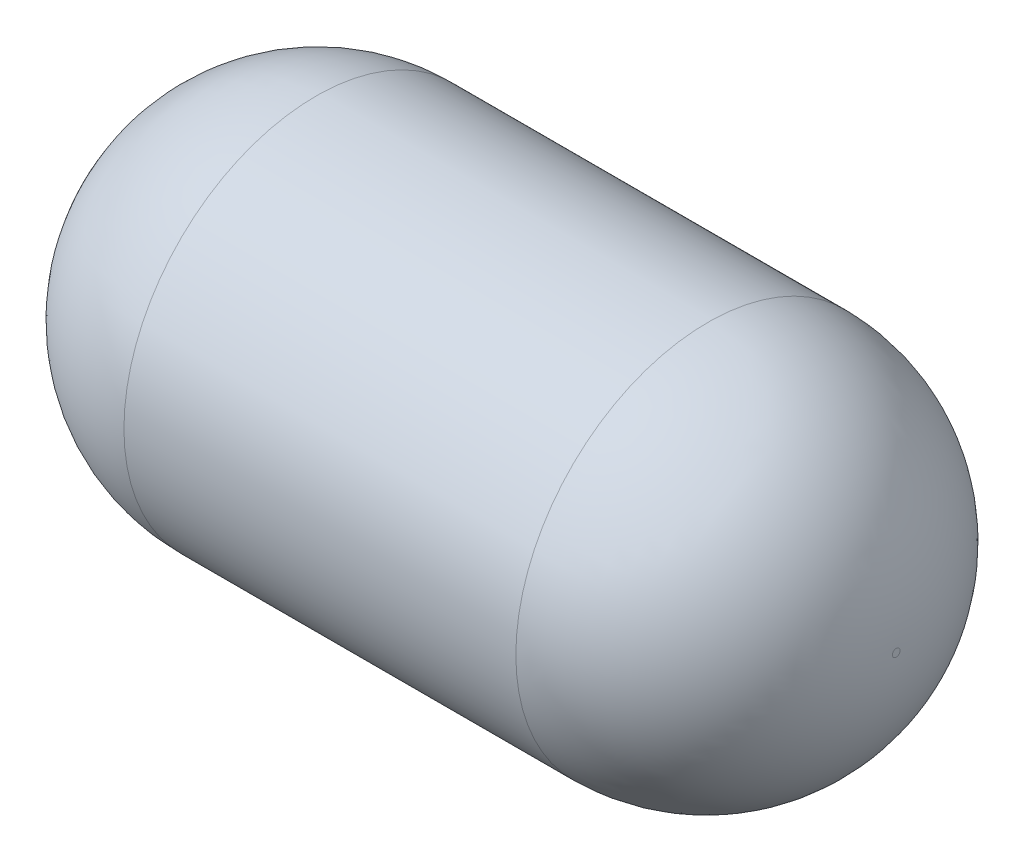
from build123d import *

# Parameters (mm, degrees)
SKETCH3_R            = 3.763336078
BOSS_EXTRUDE2_DEPTH  = 1
SKETCH4_W            = 8.980802585
SKETCH4_H            = 6.293392266
BOSS_EXTRUDE3_DEPTH  = 1
SKETCH5_W            = 10.629346859
SKETCH5_H            = 5.879063528
BOSS_EXTRUDE4_DEPTH  = 1
SKETCH6_W            = 10.265545257
SKETCH6_H            = 5.47495747
SKETCH6_W_2          = 10.065545257
SKETCH6_H_2          = 5.27495747
SKETCH6_W_3          = 9.865545257
SKETCH6_H_3          = 5.07495747
SKETCH6_W_4          = 9.665545257
SKETCH6_H_4          = 4.87495747
SKETCH6_W_5          = 9.465545257
SKETCH6_H_5          = 4.67495747
SKETCH6_W_6          = 9.265545257
SKETCH6_H_6          = 4.47495747
SKETCH6_W_7          = 9.065545257
SKETCH6_H_7          = 4.27495747
SKETCH6_W_8          = 8.865545257
SKETCH6_H_8          = 4.07495747
BOSS_EXTRUDE5_DEPTH  = 0.01
SKETCH8_W            = 8.688080535
SKETCH8_H            = 6.10037594
SKETCH8_W_2          = 8.445827339
SKETCH8_H_2          = 5.836099726
SKETCH8_W_3          = 8.288080535
SKETCH8_H_3          = 5.70037594
SKETCH8_W_4          = 8.045827339
SKETCH8_H_4          = 5.436099726
SKETCH8_W_5          = 7.645827339
SKETCH8_H_5          = 5.036099726
SKETCH8_W_6          = 7.488080535
SKETCH8_H_6          = 4.90037594
BOSS_EXTRUDE6_DEPTH  = 0.01
SKETCH9_R            = 3.620179443
SKETCH9_R_2          = 3.541138501
SKETCH9_R_3          = 3.470179443
SKETCH9_R_4          = 3.391138501
SKETCH9_R_5          = 3.320179443
SKETCH9_R_6          = 3.241138501
SKETCH9_R_7          = 3.170179443
SKETCH9_R_8          = 3.091138501
BOSS_EXTRUDE7_DEPTH  = 0.01
SKETCH10_W           = 4.944998425
SKETCH10_H           = 6.03436689
BOSS_EXTRUDE8_DEPTH  = 1
BOSS_EXTRUDE9_START  = 1.5
SKETCH10_3_W         = 4.626755952
SKETCH10_3_H         = 5.740604608
BOSS_EXTRUDE9_DEPTH  = 2
SKETCH11_R           = 1.973896033
BOSS_EXTRUDE10_DEPTH = 2


with BuildPart() as part:
    # Sketch1 → Revolve2 (revolve)
    with BuildSketch(Plane(origin=(0, 0, 0), x_dir=(1, 0, 0), z_dir=(0, 1, 0))):
        with BuildLine():
            Line((0, 0), (20, 0))
            Line((20, 0), (20, 0.1))
            ThreePointArc((20, 0.1), (18.564823228, 3.564823228), (15.1, 5))
            Line((15.1, 5), (4.9, 5))
            ThreePointArc((4.9, 5), (1.435176772, 3.564823228), (0, 0.1))
            Line((0, 0.1), (0, 0))
        make_face()
    revolve(axis=Axis((0, 0, 0), (1, 0, 0)))


with BuildPart() as body_2:
    # Sketch3 → Boss-Extrude2 (new body)
    with BuildSketch(Plane(origin=(5, 0, 0), x_dir=(0, 0, -1), z_dir=(1, 0, 0))):
        with Locations((0.1, 0)):
            Circle(SKETCH3_R)
    extrude(amount=BOSS_EXTRUDE2_DEPTH)



with BuildPart() as body_3:
    # Sketch4 → Boss-Extrude3 (new body)
    with BuildSketch(Plane.XY.offset(3)):
        with Locations((10.627395077, -0.147861703)):
            Rectangle(SKETCH4_W, SKETCH4_H)
    extrude(amount=-BOSS_EXTRUDE3_DEPTH)

    # Sketch8 → Boss-Extrude6 (add)
    # profile 1 of 3: a face of its own
    with BuildSketch(Plane(origin=(0, 0, 2), x_dir=(-1, 0, 0), z_dir=(0, 0, -1))):
        with Locations((-10.575286319, -0.156955762)):
            Rectangle(SKETCH8_W, SKETCH8_H)
        with Locations((-10.586297829, -0.156955762)):
            Rectangle(SKETCH8_W_2, SKETCH8_H_2, mode=Mode.SUBTRACT)
    # profile 2 of 3: a face of its own
    with BuildSketch(Plane(origin=(0, 0, 2), x_dir=(-1, 0, 0), z_dir=(0, 0, -1))):
        with Locations((-10.57528632, -0.156955762)):
            Rectangle(SKETCH8_W_3, SKETCH8_H_3)
        with Locations((-10.586297829, -0.156955762)):
            Rectangle(SKETCH8_W_4, SKETCH8_H_4, mode=Mode.SUBTRACT)
    # profile 3 of 3: a face of its own
    with BuildSketch(Plane(origin=(0, 0, 2), x_dir=(-1, 0, 0), z_dir=(0, 0, -1))):
        with Locations((-10.586297829, -0.156955762)):
            Rectangle(SKETCH8_W_5, SKETCH8_H_5)
        with Locations((-10.575286319, -0.156955762)):
            Rectangle(SKETCH8_W_6, SKETCH8_H_6, mode=Mode.SUBTRACT)
    extrude(amount=BOSS_EXTRUDE6_DEPTH)


with BuildPart() as body_4:
    # Sketch5 → Boss-Extrude4 (new body)
    with BuildSketch(Plane(origin=(0, 3, 0), x_dir=(1, 0, 0), z_dir=(0, 1, 0))):
        with Locations((10.079768419, 0)):
            Rectangle(SKETCH5_W, SKETCH5_H)
    extrude(amount=BOSS_EXTRUDE4_DEPTH)

    # Sketch6 → Boss-Extrude5 (add)
    # profile 1 of 4: a face of its own
    with BuildSketch(Plane(origin=(0, 4, 0), x_dir=(1, 0, 0), z_dir=(0, 1, 0))):
        with Locations((10.129371743, -0.045222422)):
            Rectangle(SKETCH6_W, SKETCH6_H)
        with Locations((10.129371743, -0.045222422)):
            Rectangle(SKETCH6_W_2, SKETCH6_H_2, mode=Mode.SUBTRACT)
    # profile 2 of 4: a face of its own
    with BuildSketch(Plane(origin=(0, 4, 0), x_dir=(1, 0, 0), z_dir=(0, 1, 0))):
        with Locations((10.129371743, -0.045222422)):
            Rectangle(SKETCH6_W_3, SKETCH6_H_3)
        with Locations((10.129371743, -0.045222422)):
            Rectangle(SKETCH6_W_4, SKETCH6_H_4, mode=Mode.SUBTRACT)
    # profile 3 of 4: a face of its own
    with BuildSketch(Plane(origin=(0, 4, 0), x_dir=(1, 0, 0), z_dir=(0, 1, 0))):
        with Locations((10.129371743, -0.045222422)):
            Rectangle(SKETCH6_W_5, SKETCH6_H_5)
        with Locations((10.129371743, -0.045222422)):
            Rectangle(SKETCH6_W_6, SKETCH6_H_6, mode=Mode.SUBTRACT)
    # profile 4 of 4: a face of its own
    with BuildSketch(Plane(origin=(0, 4, 0), x_dir=(1, 0, 0), z_dir=(0, 1, 0))):
        with Locations((10.129371743, -0.045222422)):
            Rectangle(SKETCH6_W_7, SKETCH6_H_7)
        with Locations((10.129371743, -0.045222422)):
            Rectangle(SKETCH6_W_8, SKETCH6_H_8, mode=Mode.SUBTRACT)
    extrude(amount=BOSS_EXTRUDE5_DEPTH)


with BuildPart() as body_2_1:
    add(body_2.part)

    add(body_4.part)  # Boss-Extrude7 merges body 4
    # Sketch9 → Boss-Extrude7 (add)
    # profile 1 of 4: a face of its own
    with BuildSketch(Plane(origin=(6, 0, 0), x_dir=(0, 0, -1), z_dir=(1, 0, 0))):
        Circle(SKETCH9_R)
        Circle(SKETCH9_R_2, mode=Mode.SUBTRACT)
    # profile 2 of 4: a face of its own
    with BuildSketch(Plane(origin=(6, 0, 0), x_dir=(0, 0, -1), z_dir=(1, 0, 0))):
        Circle(SKETCH9_R_3)
        Circle(SKETCH9_R_4, mode=Mode.SUBTRACT)
    # profile 3 of 4: a face of its own
    with BuildSketch(Plane(origin=(6, 0, 0), x_dir=(0, 0, -1), z_dir=(1, 0, 0))):
        Circle(SKETCH9_R_5)
        Circle(SKETCH9_R_6, mode=Mode.SUBTRACT)
    # profile 4 of 4: a face of its own
    with BuildSketch(Plane(origin=(6, 0, 0), x_dir=(0, 0, -1), z_dir=(1, 0, 0))):
        Circle(SKETCH9_R_7)
        Circle(SKETCH9_R_8, mode=Mode.SUBTRACT)
    extrude(amount=BOSS_EXTRUDE7_DEPTH)


with BuildPart() as body_4_2:
    # Sketch10 → Boss-Extrude8 (new body)
    with BuildSketch(Plane(origin=(8, 0, 0), x_dir=(0, 0, -1), z_dir=(1, 0, 0))):
        with Locations((0.684505199, -0.202278632)):
            Rectangle(SKETCH10_W, SKETCH10_H)
    extrude(amount=BOSS_EXTRUDE8_DEPTH)


with BuildPart() as body_5:
    # Sketch10<3> → Boss-Extrude9 (new body)
    with BuildSketch(Plane(origin=(8, 0, 0), x_dir=(0, 0, -1), z_dir=(1, 0, 0)).offset(BOSS_EXTRUDE9_START)):
        with Locations((0.695145233, -0.140473525)):
            Rectangle(SKETCH10_3_W, SKETCH10_3_H)
    extrude(amount=BOSS_EXTRUDE9_DEPTH)


with BuildPart() as body_6:
    # Sketch11 → Boss-Extrude10 (new, symmetric)
    with BuildSketch(Plane(origin=(14, 0, 0), x_dir=(0, 0, -1), z_dir=(1, 0, 0))):
        with Locations((0.1, 0)):
            Circle(SKETCH11_R)
    extrude(amount=BOSS_EXTRUDE10_DEPTH, both=True)

    # Sketch12 → Revolve3 (revolve)
    with BuildSketch(Plane(origin=(16, 0, 0), x_dir=(0, 0, -1), z_dir=(1, 0, 0))):
        with BuildLine():
            Line((0.1, 1.740271465), (0.1, -1.740271465))
            ThreePointArc((0.1, -1.740271465), (1.840271465, 0), (0.1, 1.740271465))
        make_face()
    revolve(axis=Axis((16, 1.740271465, -0.1), (0, -1, 0)))


solid = Compound([part.part, body_3.part, body_2_1.part, body_4_2.part, body_5.part, body_6.part])
